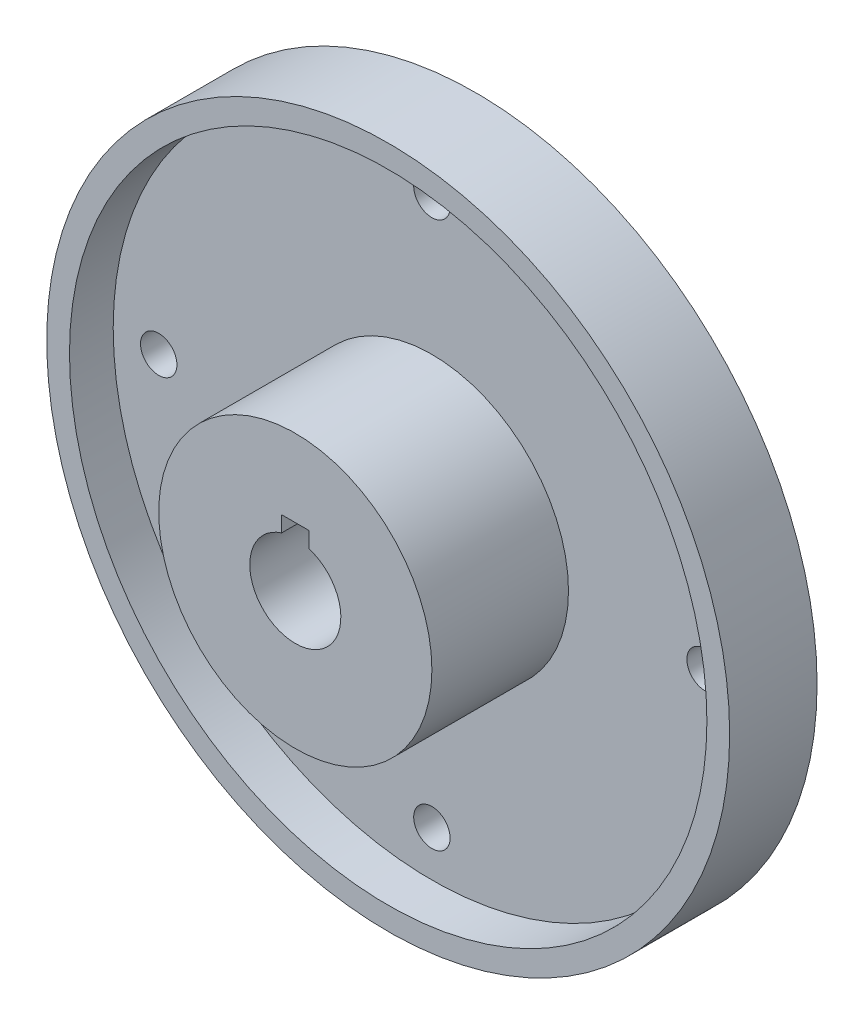
from build123d import *

# Parameters (mm, degrees)
SKETCH1_R           = 75
BOSS_EXTRUDE3_DEPTH = 19.2
SKETCH3_R           = 70
CUT_EXTRUDE1_DEPTH  = 9.6
SKETCH4_R           = 30
BOSS_EXTRUDE4_DEPTH = 30
SKETCH5_R           = 10
CUT_EXTRUDE2_DEPTH  = 57
SKETCH6_R           = 4
CUT_EXTRUDE3_DEPTH  = 57
SKETCH7_W           = 6
SKETCH7_H           = 6
CUT_EXTRUDE4_DEPTH  = 114.217313164


with BuildPart() as part:
    # Sketch1 → Boss-Extrude3 (new body)
    with BuildSketch(Plane.XY):
        Circle(SKETCH1_R)
    extrude(amount=BOSS_EXTRUDE3_DEPTH)

    # Sketch3 → Cut-Extrude1 (cut)
    with BuildSketch(Plane.XY.offset(19.2)):
        Circle(SKETCH3_R)
    extrude(amount=-CUT_EXTRUDE1_DEPTH, mode=Mode.SUBTRACT)

    # Sketch4 → Boss-Extrude4 (add)
    with BuildSketch(Plane.XY.offset(9.6)):
        Circle(SKETCH4_R)
    extrude(amount=BOSS_EXTRUDE4_DEPTH)

    # Sketch5 → Cut-Extrude2 (cut)
    with BuildSketch(Plane.XY.offset(39.6)):
        Circle(SKETCH5_R)
    extrude(amount=-CUT_EXTRUDE2_DEPTH, mode=Mode.SUBTRACT)

    # Sketch6 → Cut-Extrude3 (cut)
    with BuildSketch(Plane.XY.offset(9.6)):
        with Locations((0, 60)):
            Circle(SKETCH6_R)
        with Locations((60, 0)):
            Circle(SKETCH6_R)
        with Locations((0, -60)):
            Circle(SKETCH6_R)
        with Locations((-60, 0)):
            Circle(SKETCH6_R)
    extrude(amount=-CUT_EXTRUDE3_DEPTH, mode=Mode.SUBTRACT)

    # Sketch7 → Cut-Extrude4 (cut, through all)
    with BuildSketch(Plane.XY.offset(39.6)):
        with Locations((0, 10)):
            Rectangle(SKETCH7_W, SKETCH7_H)
    extrude(amount=-CUT_EXTRUDE4_DEPTH, mode=Mode.SUBTRACT)


solid = part.part
